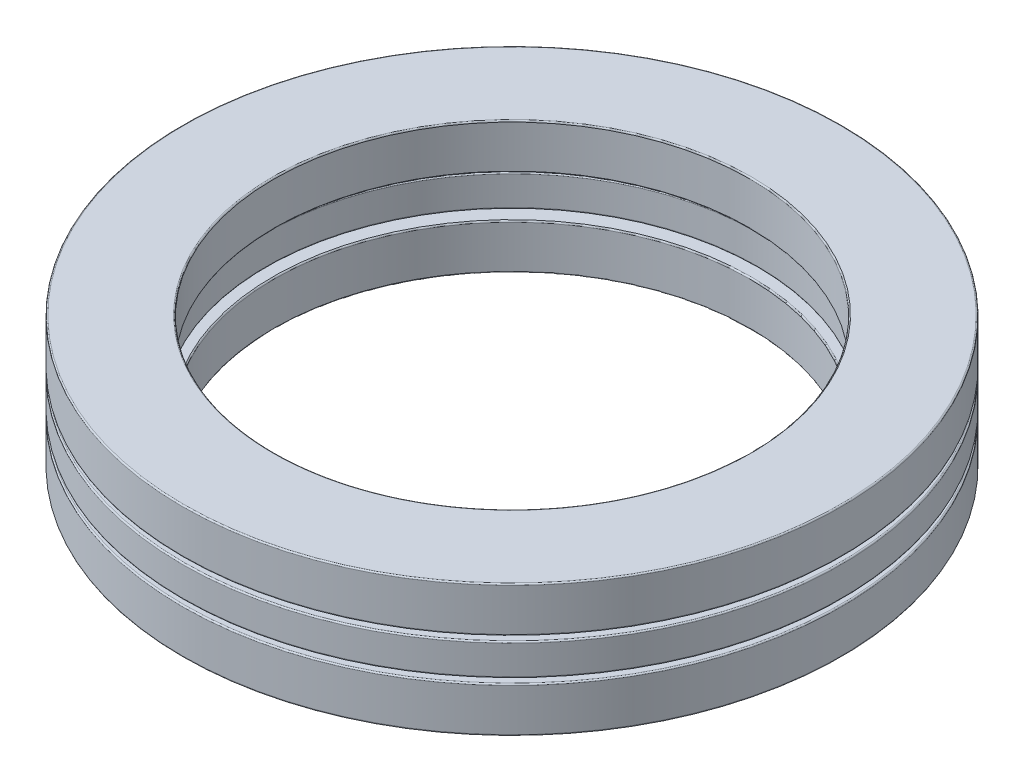
from build123d import *

# Parameters (mm, degrees)
CIRPATTERN2_COUNT = 33
CIRPATTERN3_COUNT = 33


with BuildPart() as part:
    # Sketch2 → Revolve2 (revolve)
    with BuildSketch(Plane.XY):
        with BuildLine():
            Line((-33.5, -1.9825), (-33.5, 1.9825))
            ThreePointArc((-33.5, 1.9825), (-33.552720779, 2.109779221), (-33.68, 2.1625))
            Line((-33.68, 2.1625), (-44.82, 2.1625))
            ThreePointArc((-44.82, 2.1625), (-44.947279221, 2.109779221), (-45, 1.9825))
            Line((-45, 1.9825), (-45, -1.9825))
            ThreePointArc((-45, -1.9825), (-44.947279221, -2.109779221), (-44.82, -2.1625))
            Line((-44.82, -2.1625), (-33.68, -2.1625))
            ThreePointArc((-33.68, -2.1625), (-33.552720779, -2.109779221), (-33.5, -1.9825))
        make_face()
    revolve(axis=Axis((0, -9, 0), (0, 1, 0)))

    # Sketch3 → Cut-Revolve1 (revolve, cut)
    with BuildSketch(Plane.XY):
        with BuildLine():
            Line((-39.25, 3.5225), (-39.25, -3.5225))
            ThreePointArc((-39.25, -3.5225), (-42.7725, 0), (-39.25, 3.5225))
        make_face()
    cut_revolve1 = revolve(axis=Axis((-39.25, 3.5225, 0), (0, -1, 0)), mode=Mode.SUBTRACT)

    # CirPattern2: Cut-Revolve1 ×33 about axis
    cirpattern2_axis = Axis((0, -9, 0), (0, 1, 0))
    for i in range(1, CIRPATTERN2_COUNT):
        add(cut_revolve1.rotate(cirpattern2_axis, i * 360 / CIRPATTERN2_COUNT), mode=Mode.SUBTRACT)


with BuildPart() as body_2:
    # Sketch4 → Revolve3 (revolve)
    with BuildSketch(Plane.XY):
        with BuildLine():
            Line((-44.82, 2.8425), (-41.330432647, 2.8425))
            ThreePointArc((-41.330432647, 2.8425), (-39.25, 3.5225), (-37.169567353, 2.8425))
            Line((-37.169567353, 2.8425), (-32.68, 2.8425))
            ThreePointArc((-32.68, 2.8425), (-32.552720779, 2.895220779), (-32.5, 3.0225))
            Line((-32.5, 3.0225), (-32.5, 8.82))
            ThreePointArc((-32.5, 8.82), (-32.552720779, 8.947279221), (-32.68, 9))
            Line((-32.68, 9), (-44.82, 9))
            ThreePointArc((-44.82, 9), (-44.947279221, 8.947279221), (-45, 8.82))
            Line((-45, 8.82), (-45, 3.0225))
            ThreePointArc((-45, 3.0225), (-44.947279221, 2.895220779), (-44.82, 2.8425))
        make_face()
    revolve(axis=Axis((0, -9, 0), (0, 1, 0)))


with BuildPart() as body_3:
    # Mirror1: mirrored copy
    add(body_2.part.mirror(Plane.ZX))


with BuildPart() as body_4:
    # Sketch5 → Revolve4 (revolve)
    with BuildSketch(Plane.XY):
        with BuildLine():
            Line((-39.25, 3.46), (-39.25, -3.46))
            ThreePointArc((-39.25, -3.46), (-42.71, 0), (-39.25, 3.46))
        make_face()
    revolve(axis=Axis((-39.25, 3.46, 0), (0, -1, 0)))


with BuildPart() as cirpattern3_1:
    # CirPattern3: pattern copy
    add(body_4.part.rotate(Axis((0, -9, 0), (0, 1, 0)), 1 * 360 / CIRPATTERN3_COUNT))


with BuildPart() as cirpattern3_2:
    # CirPattern3: pattern copy
    add(body_4.part.rotate(Axis((0, -9, 0), (0, 1, 0)), 2 * 360 / CIRPATTERN3_COUNT))


with BuildPart() as cirpattern3_3:
    # CirPattern3: pattern copy
    add(body_4.part.rotate(Axis((0, -9, 0), (0, 1, 0)), 3 * 360 / CIRPATTERN3_COUNT))


with BuildPart() as cirpattern3_4:
    # CirPattern3: pattern copy
    add(body_4.part.rotate(Axis((0, -9, 0), (0, 1, 0)), 4 * 360 / CIRPATTERN3_COUNT))


with BuildPart() as cirpattern3_5:
    # CirPattern3: pattern copy
    add(body_4.part.rotate(Axis((0, -9, 0), (0, 1, 0)), 5 * 360 / CIRPATTERN3_COUNT))


with BuildPart() as cirpattern3_6:
    # CirPattern3: pattern copy
    add(body_4.part.rotate(Axis((0, -9, 0), (0, 1, 0)), 6 * 360 / CIRPATTERN3_COUNT))


with BuildPart() as cirpattern3_7:
    # CirPattern3: pattern copy
    add(body_4.part.rotate(Axis((0, -9, 0), (0, 1, 0)), 7 * 360 / CIRPATTERN3_COUNT))


with BuildPart() as cirpattern3_8:
    # CirPattern3: pattern copy
    add(body_4.part.rotate(Axis((0, -9, 0), (0, 1, 0)), 8 * 360 / CIRPATTERN3_COUNT))


with BuildPart() as cirpattern3_9:
    # CirPattern3: pattern copy
    add(body_4.part.rotate(Axis((0, -9, 0), (0, 1, 0)), 9 * 360 / CIRPATTERN3_COUNT))


with BuildPart() as cirpattern3_10:
    # CirPattern3: pattern copy
    add(body_4.part.rotate(Axis((0, -9, 0), (0, 1, 0)), 10 * 360 / CIRPATTERN3_COUNT))


with BuildPart() as cirpattern3_11:
    # CirPattern3: pattern copy
    add(body_4.part.rotate(Axis((0, -9, 0), (0, 1, 0)), 11 * 360 / CIRPATTERN3_COUNT))


with BuildPart() as cirpattern3_12:
    # CirPattern3: pattern copy
    add(body_4.part.rotate(Axis((0, -9, 0), (0, 1, 0)), 12 * 360 / CIRPATTERN3_COUNT))


with BuildPart() as cirpattern3_13:
    # CirPattern3: pattern copy
    add(body_4.part.rotate(Axis((0, -9, 0), (0, 1, 0)), 13 * 360 / CIRPATTERN3_COUNT))


with BuildPart() as cirpattern3_14:
    # CirPattern3: pattern copy
    add(body_4.part.rotate(Axis((0, -9, 0), (0, 1, 0)), 14 * 360 / CIRPATTERN3_COUNT))


with BuildPart() as cirpattern3_15:
    # CirPattern3: pattern copy
    add(body_4.part.rotate(Axis((0, -9, 0), (0, 1, 0)), 15 * 360 / CIRPATTERN3_COUNT))


with BuildPart() as cirpattern3_16:
    # CirPattern3: pattern copy
    add(body_4.part.rotate(Axis((0, -9, 0), (0, 1, 0)), 16 * 360 / CIRPATTERN3_COUNT))


with BuildPart() as cirpattern3_17:
    # CirPattern3: pattern copy
    add(body_4.part.rotate(Axis((0, -9, 0), (0, 1, 0)), 17 * 360 / CIRPATTERN3_COUNT))


with BuildPart() as cirpattern3_18:
    # CirPattern3: pattern copy
    add(body_4.part.rotate(Axis((0, -9, 0), (0, 1, 0)), 18 * 360 / CIRPATTERN3_COUNT))


with BuildPart() as cirpattern3_19:
    # CirPattern3: pattern copy
    add(body_4.part.rotate(Axis((0, -9, 0), (0, 1, 0)), 19 * 360 / CIRPATTERN3_COUNT))


with BuildPart() as cirpattern3_20:
    # CirPattern3: pattern copy
    add(body_4.part.rotate(Axis((0, -9, 0), (0, 1, 0)), 20 * 360 / CIRPATTERN3_COUNT))


with BuildPart() as cirpattern3_21:
    # CirPattern3: pattern copy
    add(body_4.part.rotate(Axis((0, -9, 0), (0, 1, 0)), 21 * 360 / CIRPATTERN3_COUNT))


with BuildPart() as cirpattern3_22:
    # CirPattern3: pattern copy
    add(body_4.part.rotate(Axis((0, -9, 0), (0, 1, 0)), 22 * 360 / CIRPATTERN3_COUNT))


with BuildPart() as cirpattern3_23:
    # CirPattern3: pattern copy
    add(body_4.part.rotate(Axis((0, -9, 0), (0, 1, 0)), 23 * 360 / CIRPATTERN3_COUNT))


with BuildPart() as cirpattern3_24:
    # CirPattern3: pattern copy
    add(body_4.part.rotate(Axis((0, -9, 0), (0, 1, 0)), 24 * 360 / CIRPATTERN3_COUNT))


with BuildPart() as cirpattern3_25:
    # CirPattern3: pattern copy
    add(body_4.part.rotate(Axis((0, -9, 0), (0, 1, 0)), 25 * 360 / CIRPATTERN3_COUNT))


with BuildPart() as cirpattern3_26:
    # CirPattern3: pattern copy
    add(body_4.part.rotate(Axis((0, -9, 0), (0, 1, 0)), 26 * 360 / CIRPATTERN3_COUNT))


with BuildPart() as cirpattern3_27:
    # CirPattern3: pattern copy
    add(body_4.part.rotate(Axis((0, -9, 0), (0, 1, 0)), 27 * 360 / CIRPATTERN3_COUNT))


with BuildPart() as cirpattern3_28:
    # CirPattern3: pattern copy
    add(body_4.part.rotate(Axis((0, -9, 0), (0, 1, 0)), 28 * 360 / CIRPATTERN3_COUNT))


with BuildPart() as cirpattern3_29:
    # CirPattern3: pattern copy
    add(body_4.part.rotate(Axis((0, -9, 0), (0, 1, 0)), 29 * 360 / CIRPATTERN3_COUNT))


with BuildPart() as cirpattern3_30:
    # CirPattern3: pattern copy
    add(body_4.part.rotate(Axis((0, -9, 0), (0, 1, 0)), 30 * 360 / CIRPATTERN3_COUNT))


with BuildPart() as cirpattern3_31:
    # CirPattern3: pattern copy
    add(body_4.part.rotate(Axis((0, -9, 0), (0, 1, 0)), 31 * 360 / CIRPATTERN3_COUNT))


with BuildPart() as cirpattern3_32:
    # CirPattern3: pattern copy
    add(body_4.part.rotate(Axis((0, -9, 0), (0, 1, 0)), 32 * 360 / CIRPATTERN3_COUNT))


solid = Compound([part.part, body_2.part, body_3.part, body_4.part, cirpattern3_1.part, cirpattern3_2.part, cirpattern3_3.part, cirpattern3_4.part, cirpattern3_5.part, cirpattern3_6.part, cirpattern3_7.part, cirpattern3_8.part, cirpattern3_9.part, cirpattern3_10.part, cirpattern3_11.part, cirpattern3_12.part, cirpattern3_13.part, cirpattern3_14.part, cirpattern3_15.part, cirpattern3_16.part, cirpattern3_17.part, cirpattern3_18.part, cirpattern3_19.part, cirpattern3_20.part, cirpattern3_21.part, cirpattern3_22.part, cirpattern3_23.part, cirpattern3_24.part, cirpattern3_25.part, cirpattern3_26.part, cirpattern3_27.part, cirpattern3_28.part, cirpattern3_29.part, cirpattern3_30.part, cirpattern3_31.part, cirpattern3_32.part])
